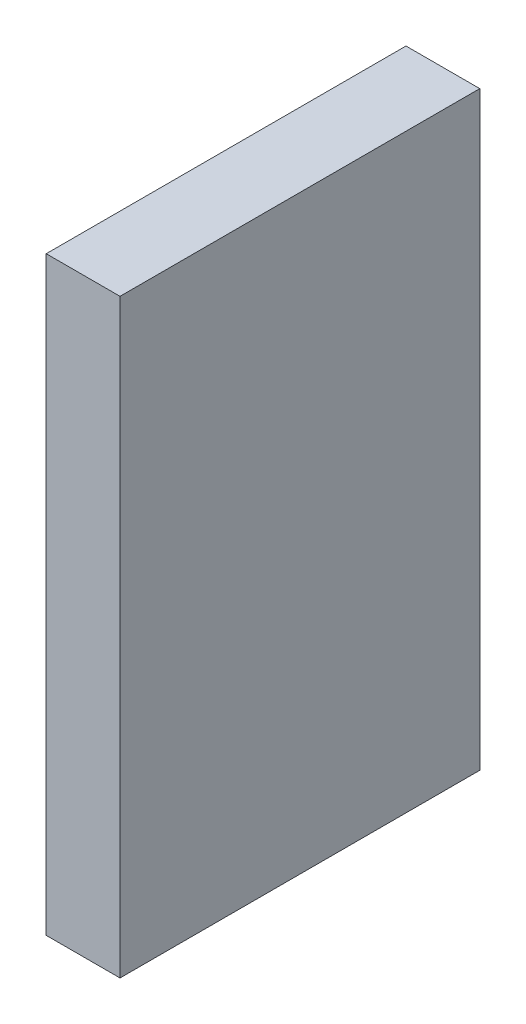
from build123d import *

# Parameters (mm, degrees)
SKETCH1_W           = 4
SKETCH1_H           = 32
BOSS_EXTRUDE1_DEPTH = 19.5


with BuildPart() as part:
    # Sketch1 → Boss-Extrude1 (new body)
    with BuildSketch(Plane.XY):
        Rectangle(SKETCH1_W, SKETCH1_H)
    extrude(amount=BOSS_EXTRUDE1_DEPTH)


solid = part.part
